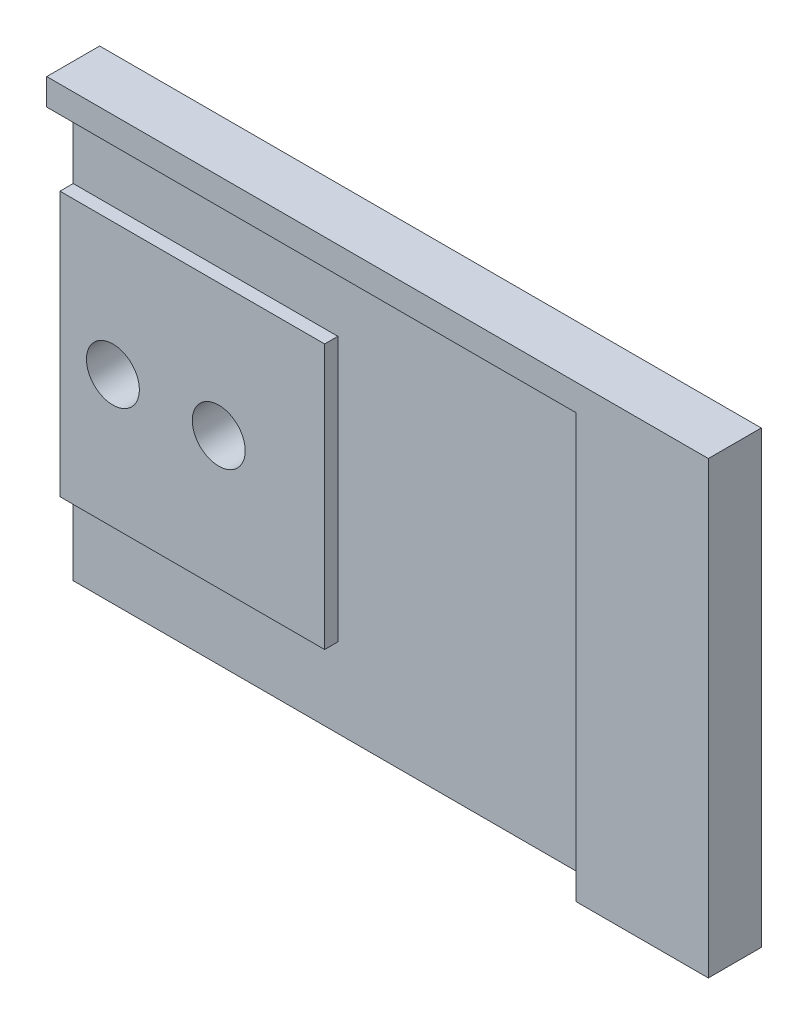
from build123d import *

# Parameters (mm, degrees)
SKIZZE1_W                       = 125
SKIZZE1_H                       = 85
AUFSATZ_LINEAR_AUSTRAGEN1_DEPTH = 10
SKIZZE2_W                       = 100
SKIZZE2_H                       = 80
SCHNITT_LINEAR_AUSTRAGEN1_DEPTH = 5
SKIZZE3_W                       = 50
SKIZZE3_H                       = 50
AUFSATZ_LINEAR_AUSTRAGEN2_DEPTH = 2.5
SKIZZE4_R                       = 5
SCHNITT_LINEAR_AUSTRAGEN2_DEPTH = 22.5


with BuildPart() as part:
    # Skizze1 → Aufsatz-Linear austragen1 (new body)
    with BuildSketch(Plane.XY):
        with Locations((16.213851874, -21.700636943)):
            Rectangle(SKIZZE1_W, SKIZZE1_H)
    extrude(amount=AUFSATZ_LINEAR_AUSTRAGEN1_DEPTH)

    # Skizze2 → Schnitt-Linear austragen1 (cut)
    with BuildSketch(Plane.XY.offset(10)):
        with Locations((3.713851874, -24.200636943)):
            Rectangle(SKIZZE2_W, SKIZZE2_H)
    extrude(amount=-SCHNITT_LINEAR_AUSTRAGEN1_DEPTH, mode=Mode.SUBTRACT)

    # Skizze3 → Aufsatz-Linear austragen2 (add)
    with BuildSketch(Plane.XY.offset(5)):
        with Locations((-21.286148126, -24.200636943)):
            Rectangle(SKIZZE3_W, SKIZZE3_H)
    extrude(amount=AUFSATZ_LINEAR_AUSTRAGEN2_DEPTH)

    # Skizze4 → Schnitt-Linear austragen2 (cut)
    with BuildSketch(Plane.XY.offset(7.5)):
        with Locations((-36.286148126, -24.200636943)):
            Circle(SKIZZE4_R)
        with Locations((-16.286148126, -24.200636943)):
            Circle(SKIZZE4_R)
    extrude(amount=-SCHNITT_LINEAR_AUSTRAGEN2_DEPTH, mode=Mode.SUBTRACT)


solid = part.part
